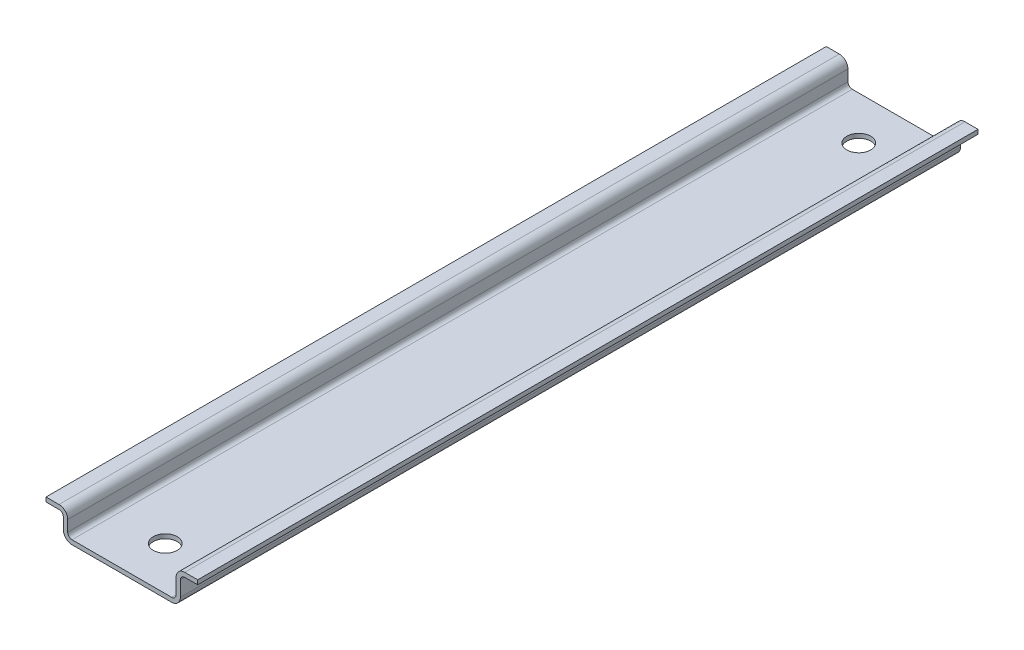
from build123d import *

# Parameters (mm, degrees)
BOSS_EXTRUDE1_DEPTH = 180
SKETCH2_R           = 2.75
CUT_EXTRUDE1_DEPTH  = 1


with BuildPart() as part:
    # Sketch1 → Boss-Extrude1 (new body)
    with BuildSketch(Plane.XY):
        with BuildLine():
            Line((2, 0), (25, 0))
            ThreePointArc((25, 0), (26.414213562, 0.585786438), (27, 2))
            Line((27, 2), (27, 5.5))
            ThreePointArc((27, 5.5), (27.292893219, 6.207106781), (28, 6.5))
            Line((28, 6.5), (31, 6.5))
            Line((31, 6.5), (31, 7.5))
            Line((31, 7.5), (28, 7.5))
            ThreePointArc((28, 7.5), (26.585786438, 6.914213562), (26, 5.5))
            Line((26, 5.5), (26, 2))
            ThreePointArc((26, 2), (25.707106781, 1.292893219), (25, 1))
            Line((25, 1), (2, 1))
            ThreePointArc((2, 1), (1.292893219, 1.292893219), (1, 2))
            Line((1, 2), (1, 4.544540718))
            ThreePointArc((1, 4.544540718), (0.414213562, 5.95875428), (-1, 6.544540718))
            Line((-1, 6.544540718), (-4, 6.544540718))
            Line((-4, 6.544540718), (-4, 5.544540718))
            Line((-4, 5.544540718), (-1, 5.544540718))
            ThreePointArc((-1, 5.544540718), (-0.292893219, 5.251647499), (0, 4.544540718))
            Line((0, 4.544540718), (0, 2))
            ThreePointArc((0, 2), (0.585786438, 0.585786438), (2, 0))
        make_face()
    extrude(amount=BOSS_EXTRUDE1_DEPTH)

    # Sketch2 → Cut-Extrude1 (cut)
    with BuildSketch(Plane(origin=(0, 1, 0), x_dir=(1, 0, 0), z_dir=(0, 1, 0))):
        with Locations(Location((13.5, -10, 0), (0, 0, 270))):
            Circle(SKETCH2_R)
        with Locations(Location((13.5, -170, 0), (0, 0, 270))):
            Circle(SKETCH2_R)
    extrude(amount=-CUT_EXTRUDE1_DEPTH, mode=Mode.SUBTRACT)


solid = part.part
